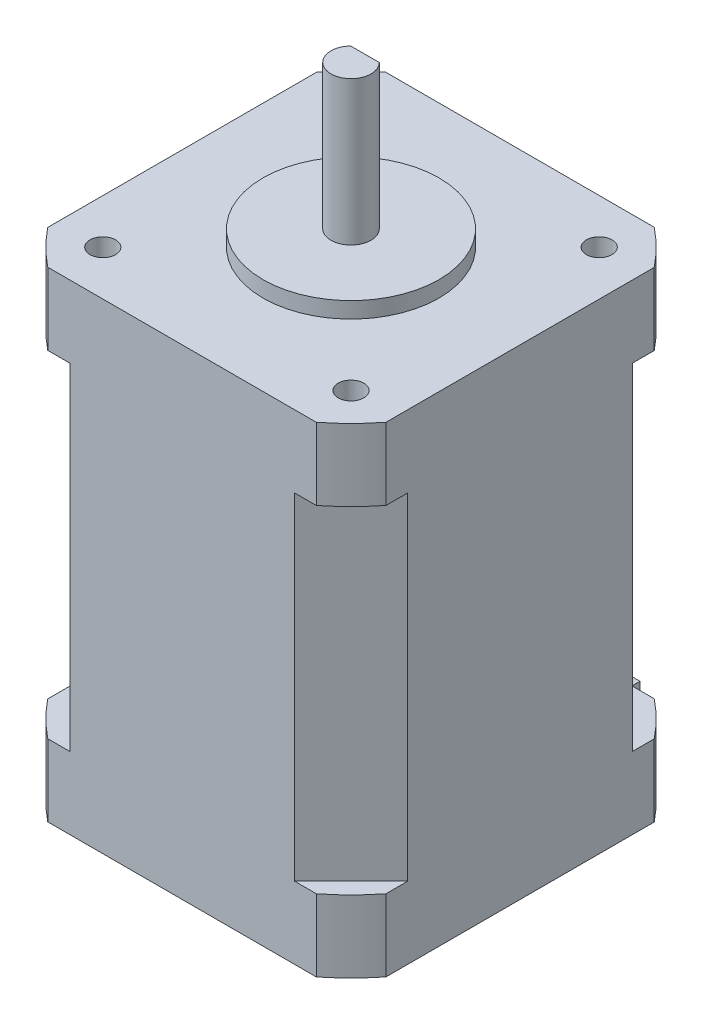
from build123d import *

# Parameters (mm, degrees)
EXTRUDE_1_DEPTH     = 60
EXTRUDE_2_DEPTH     = 9
SKETCH_7_R          = 11
EXTRUDE_3_DEPTH     = 2
SKETCH_8_R          = 2.5
EXTRUDE_4_DEPTH     = 18
CUT_EXTRUDE_START   = -15
CUT_EXTRUDE_1_DEPTH = 15
SKETCH_10_R         = 1.6
CUT_EXTRUDE_2_DEPTH = 4.5
EXTRUDE_5_DEPTH     = 5
CUT_EXTRUDE_3_DEPTH = 5
SKETCH_13_R         = 0.562342784
EXTRUDE_6_DEPTH     = 5
SKETCH_14_R         = 2
SKETCH_14_R_2       = 1.75
CUT_EXTRUDE_4_DEPTH = 1


with BuildPart() as part:
    # 草图2 → 凸台-拉伸1 (new body)
    with BuildSketch(Plane(origin=(0, 0, 0), x_dir=(1, 0, 0), z_dir=(0, 1, 0))):
        Polygon((-14.012734328, 22.447763171), (-21.08380214, 15.376695359), (-21.08380214, -12.681169017), (-14.012734328, -19.752236829), (14.045130048, -19.752236829), (21.11619786, -12.681169017), (21.11619786, 15.376695359), (14.045130048, 22.447763171), align=None)
    extrude(amount=EXTRUDE_1_DEPTH)

    # 草图5 → 凸台-拉伸2 (add)
    with BuildSketch(Plane(origin=(0, 60, 0), x_dir=(1, 0, 0), z_dir=(0, 1, 0))):
        with BuildLine():
            Line((-16.776242784, 22.447763171), (16.776242784, 22.447763171))
            ThreePointArc((16.776242784, 22.447763171), (19.070321818, 20.399669839), (21.11619786, 18.103613191))
            Line((21.11619786, 18.103613191), (21.11619786, -15.408086849))
            ThreePointArc((21.11619786, -15.408086849), (19.070321818, -17.704143498), (16.776242784, -19.752236829))
            Line((16.776242784, -19.752236829), (-16.776242784, -19.752236829))
            ThreePointArc((-16.776242784, -19.752236829), (-19.051917848, -17.722547478), (-21.08380214, -15.448831998))
            Line((-21.08380214, -15.448831998), (-21.08380214, 18.14435834))
            ThreePointArc((-21.08380214, 18.14435834), (-19.051917848, 20.41807382), (-16.776242784, 22.447763171))
        make_face()
    extrude_2 = extrude(amount=-EXTRUDE_2_DEPTH)

    # 镜向1: 凸台-拉伸2 across plane
    add(extrude_2.mirror(Plane.ZX.offset(30)))

    # 草图7 → 凸台-拉伸3 (add)
    with BuildSketch(Plane(origin=(0, 60, 0), x_dir=(1, 0, 0), z_dir=(0, 1, 0))):
        with Locations(Location((0, 1.347763171, 0), (0, 0, 270))):
            Circle(SKETCH_7_R)
    extrude(amount=EXTRUDE_3_DEPTH)

    # 草图8 → 凸台-拉伸4 (add)
    with BuildSketch(Plane(origin=(0, 62, 0), x_dir=(1, 0, 0), z_dir=(0, 1, 0))):
        with Locations(Location((0, 1.347763171, 0), (0, 0, 270))):
            Circle(SKETCH_8_R)
    extrude(amount=EXTRUDE_4_DEPTH)

    # 草图9 → 切除-拉伸1 (cut)
    with BuildSketch(Plane(origin=(0, 80, 0), x_dir=(1, 0, 0), z_dir=(0, 1, 0)).offset(CUT_EXTRUDE_START)):
        with BuildLine():
            Line((-1.785357107, 3.097763171), (1.785357107, 3.097763171))
            ThreePointArc((1.785357107, 3.097763171), (0, 3.847763171), (-1.785357107, 3.097763171))
        make_face()
    extrude(amount=CUT_EXTRUDE_1_DEPTH, mode=Mode.SUBTRACT)

    # 草图10 → 切除-拉伸2 (cut)
    with BuildSketch(Plane(origin=(0, 60, 0), x_dir=(1, 0, 0), z_dir=(0, 1, 0))):
        with Locations(Location((-15.5, 16.847763171, 0), (0, 0, 270))):
            Circle(SKETCH_10_R)
        with Locations(Location((15.5, 16.847763171, 0), (0, 0, 270))):
            Circle(SKETCH_10_R)
        with Locations(Location((15.5, -14.152236829, 0), (0, 0, 270))):
            Circle(SKETCH_10_R)
        with Locations(Location((-15.5, -14.152236829, 0), (0, 0, 270))):
            Circle(SKETCH_10_R)
    extrude(amount=-CUT_EXTRUDE_2_DEPTH, mode=Mode.SUBTRACT)

    # 草图11 → 凸台-拉伸5 (add)
    with BuildSketch(Plane(origin=(0, 0, -22.447763171), x_dir=(-1, 0, 0), z_dir=(0, 0, -1))):
        Polygon((10, 0), (-10, 0), (-10, 5), (-9, 5), (-9, 1), (9, 1), (9, 5), (10, 5), align=None)
    extrude(amount=EXTRUDE_5_DEPTH)

    # 草图12 → 切除-拉伸3 (cut)
    with BuildSketch(Plane.XZ):
        Polygon((-7.144738058, -27.447763171), (-7.144738058, -24.447763171), (-7.644738058, -24.447763171), (-7.644738058, -26.447763171), (-8.144738058, -26.447763171), (-7.644738058, -27.447763171), align=None)
        Polygon((7.644738058, -27.447763171), (7.144738058, -27.447763171), (7.144738058, -24.447763171), (7.644738058, -24.447763171), (7.644738058, -26.447763171), (8.144738058, -26.447763171), align=None)
    extrude(amount=-CUT_EXTRUDE_3_DEPTH, mode=Mode.SUBTRACT)

    # 草图13 → 凸台-拉伸6 (add)
    with BuildSketch(Plane(origin=(0, 0, -22.447763171), x_dir=(-1, 0, 0), z_dir=(0, 0, -1))):
        with Locations(Location((-1.27, 3.54, 0), (0, 0, 180))):
            Circle(SKETCH_13_R)
        with Locations(Location((-3.81, 3.54, 0), (0, 0, 180))):
            Circle(SKETCH_13_R)
        with Locations(Location((-6.35, 3.54, 0), (0, 0, 180))):
            Circle(SKETCH_13_R)
        with Locations(Location((6.35, 3.54, 0), (0, 0, 180))):
            Circle(SKETCH_13_R)
        with Locations(Location((3.81, 3.54, 0), (0, 0, 180))):
            Circle(SKETCH_13_R)
        with Locations(Location((1.27, 3.54, 0), (0, 0, 180))):
            Circle(SKETCH_13_R)
    extrude(amount=EXTRUDE_6_DEPTH)

    # 草图14 → 切除-拉伸4 (cut)
    # profile 1 of 4: a face of its own
    with BuildSketch(Plane.XZ):
        with Locations(Location((14.11619786, 12.752236829, 0), (0, 0, 270))):
            Circle(SKETCH_14_R)
        with Locations(Location((14.11619786, 12.752236829, 0), (0, 0, 270))):
            Circle(SKETCH_14_R_2, mode=Mode.SUBTRACT)
    # profile 2 of 4: a face of its own
    with BuildSketch(Plane.XZ):
        with Locations(Location((12.752236829, -14.11619786, 0), (0, 0, 270))):
            Circle(SKETCH_14_R)
        with Locations(Location((12.752236829, -14.11619786, 0), (0, 0, 270))):
            Circle(SKETCH_14_R_2, mode=Mode.SUBTRACT)
    # profile 3 of 4: a face of its own
    with BuildSketch(Plane.XZ):
        with Locations(Location((-14.11619786, -12.752236829, 0), (0, 0, 270))):
            Circle(SKETCH_14_R)
        with Locations(Location((-14.11619786, -12.752236829, 0), (0, 0, 270))):
            Circle(SKETCH_14_R_2, mode=Mode.SUBTRACT)
    # profile 4 of 4: a face of its own
    with BuildSketch(Plane.XZ):
        with Locations(Location((-12.752236829, 14.11619786, 0), (0, 0, 270))):
            Circle(SKETCH_14_R)
        with Locations(Location((-12.752236829, 14.11619786, 0), (0, 0, 270))):
            Circle(SKETCH_14_R_2, mode=Mode.SUBTRACT)
    extrude(amount=-CUT_EXTRUDE_4_DEPTH, mode=Mode.SUBTRACT)


solid = part.part
